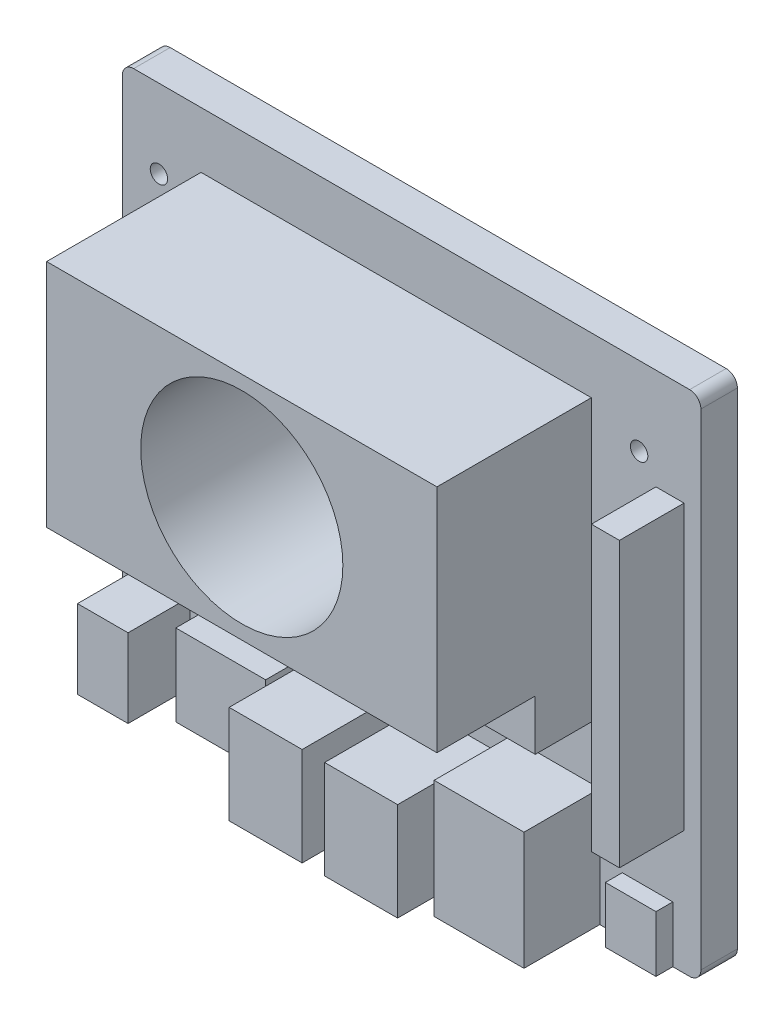
from build123d import *

# Parameters (mm, degrees)
SKETCH_1_W          = 103
SKETCH_1_H          = 90.5
EXTRUDE_1_DEPTH     = 6.5
SKETCH_2_W          = 9
SKETCH_2_H          = 14
SKETCH_2_W_2        = 16
SKETCH_2_H_2        = 14.5
SKETCH_2_W_3        = 13
SKETCH_2_H_3        = 17.5
SKETCH_2_H_4        = 21
SKETCH_2_H_5        = 10
SKETCH_2_W_4        = 69.5
SKETCH_2_H_6        = 50
SKETCH_2_R          = 18
SKETCH_2_W_5        = 2.5
SKETCH_2_H_7        = 19
SKETCH_2_W_6        = 5
SKETCH_2_H_8        = 50.5
EXTRUDE_2_DEPTH     = 27.5
CUT_EXTRUDE_1_REACH = 143.263
SKETCH_3_W          = 9
SKETCH_3_H          = 16.5
SKETCH_3_W_2        = 16
SKETCH_3_H_2        = 21
SKETCH_3_W_3        = 13
SKETCH_3_H_3        = 10.5
SKETCH_3_H_4        = 14
SKETCH_3_H_5        = 24.5
SKETCH_4_W          = 69.5
SKETCH_4_H          = 9
CUT_EXTRUDE_2_DEPTH = 17.5
SKETCH_5_R          = 1.55
CUT_EXTRUDE_3_DEPTH = 140.840981118
CUT_EXTRUDE_4_REACH = 135.8
SKETCH_6_W          = 21
SKETCH_6_H          = 19
CUT_EXTRUDE_5_REACH = 141.091
SKETCH_7_W          = 16
SKETCH_7_H          = 50.5
FILLET_1_R          = 2


with BuildPart() as part:
    # 草图1 → 凸台-拉伸1 (new body)
    with BuildSketch(Plane.XY):
        with Locations((51.5, 45.25)):
            Rectangle(SKETCH_1_W, SKETCH_1_H)
    extrude(amount=EXTRUDE_1_DEPTH)

    # 草图2 → 凸台-拉伸2 (add)
    # profile 1 of 9: a face of its own
    with BuildSketch(Plane.XY.offset(6.5)):
        with Locations((7.5, 7)):
            Rectangle(SKETCH_2_W, SKETCH_2_H)
    # profile 2 of 9: a face of its own
    with BuildSketch(Plane.XY.offset(6.5)):
        with Locations((24, 7.25)):
            Rectangle(SKETCH_2_W_2, SKETCH_2_H_2)
    # profile 3 of 9: a face of its own
    with BuildSketch(Plane.XY.offset(6.5)):
        with Locations((42.5, 8.75)):
            Rectangle(SKETCH_2_W_3, SKETCH_2_H_3)
    # profile 4 of 9: a face of its own
    with BuildSketch(Plane.XY.offset(6.5)):
        with Locations((59.5, 8.75)):
            Rectangle(SKETCH_2_W_3, SKETCH_2_H_3)
    # profile 5 of 9: a face of its own
    with BuildSketch(Plane.XY.offset(6.5)):
        with Locations((77, 10.5)):
            Rectangle(SKETCH_2_W_2, SKETCH_2_H_4)
    # profile 6 of 9: a face of its own
    with BuildSketch(Plane.XY.offset(6.5)):
        with Locations((93.5, 5)):
            Rectangle(SKETCH_2_W, SKETCH_2_H_5)
    # profile 7 of 9: a face of its own
    with BuildSketch(Plane.XY.offset(6.5)):
        with Locations((48.75, 55.5)):
            Rectangle(SKETCH_2_W_4, SKETCH_2_H_6)
        with Locations((48.75, 60)):
            Circle(SKETCH_2_R, mode=Mode.SUBTRACT)
    # profile 8 of 9: a face of its own
    with BuildSketch(Plane.XY.offset(6.5)):
        with Locations((91.25, 58)):
            Rectangle(SKETCH_2_W_5, SKETCH_2_H_7)
    # profile 9 of 9: a face of its own
    with BuildSketch(Plane.XY.offset(6.5)):
        with Locations((97.5, 47.25)):
            Rectangle(SKETCH_2_W_6, SKETCH_2_H_8)
    extrude(amount=EXTRUDE_2_DEPTH)

    # 草图3 → 切除-拉伸1 (cut, up to next)
    with BuildSketch(Plane.XZ, mode=Mode.PRIVATE) as cut_extrude_1_sk1:
        with Locations((7.5, 25.75)):
            Rectangle(SKETCH_3_W, SKETCH_3_H)
    cut_extrude_1_tool1 = extrude(cut_extrude_1_sk1.sketch, amount=-CUT_EXTRUDE_1_REACH, mode=Mode.PRIVATE) & part.part
    # 草图3 → 切除-拉伸1 (cut, up to next)
    with BuildSketch(Plane.XZ, mode=Mode.PRIVATE) as cut_extrude_1_sk2:
        with Locations((24, 23.5)):
            Rectangle(SKETCH_3_W_2, SKETCH_3_H_2)
    cut_extrude_1_tool2 = extrude(cut_extrude_1_sk2.sketch, amount=-CUT_EXTRUDE_1_REACH, mode=Mode.PRIVATE) & part.part
    # 草图3 → 切除-拉伸1 (cut, up to next)
    with BuildSketch(Plane.XZ, mode=Mode.PRIVATE) as cut_extrude_1_sk3:
        with Locations((42.5, 28.75)):
            Rectangle(SKETCH_3_W_3, SKETCH_3_H_3)
    cut_extrude_1_tool3 = extrude(cut_extrude_1_sk3.sketch, amount=-CUT_EXTRUDE_1_REACH, mode=Mode.PRIVATE) & part.part
    # 草图3 → 切除-拉伸1 (cut, up to next)
    with BuildSketch(Plane.XZ, mode=Mode.PRIVATE) as cut_extrude_1_sk4:
        with Locations((59.5, 28.75)):
            Rectangle(SKETCH_3_W_3, SKETCH_3_H_3)
    cut_extrude_1_tool4 = extrude(cut_extrude_1_sk4.sketch, amount=-CUT_EXTRUDE_1_REACH, mode=Mode.PRIVATE) & part.part
    # 草图3 → 切除-拉伸1 (cut, up to next)
    with BuildSketch(Plane.XZ, mode=Mode.PRIVATE) as cut_extrude_1_sk5:
        with Locations((77, 27)):
            Rectangle(SKETCH_3_W_2, SKETCH_3_H_4)
    cut_extrude_1_tool5 = extrude(cut_extrude_1_sk5.sketch, amount=-CUT_EXTRUDE_1_REACH, mode=Mode.PRIVATE) & part.part
    # 草图3 → 切除-拉伸1 (cut, up to next)
    with BuildSketch(Plane.XZ, mode=Mode.PRIVATE) as cut_extrude_1_sk6:
        with Locations((93.5, 21.75)):
            Rectangle(SKETCH_3_W, SKETCH_3_H_5)
    cut_extrude_1_tool6 = extrude(cut_extrude_1_sk6.sketch, amount=-CUT_EXTRUDE_1_REACH, mode=Mode.PRIVATE) & part.part
    add(cut_extrude_1_tool1.solids().sort_by_distance((7.5, 0, 25.75))[0], mode=Mode.SUBTRACT)
    add(cut_extrude_1_tool2.solids().sort_by_distance((24, 0, 23.5))[0], mode=Mode.SUBTRACT)
    add(cut_extrude_1_tool3.solids().sort_by_distance((42.5, 0, 28.75))[0], mode=Mode.SUBTRACT)
    add(cut_extrude_1_tool4.solids().sort_by_distance((59.5, 0, 28.75))[0], mode=Mode.SUBTRACT)
    add(cut_extrude_1_tool5.solids().sort_by_distance((77, 0, 27))[0], mode=Mode.SUBTRACT)
    add(cut_extrude_1_tool6.solids().sort_by_distance((93.5, 0, 21.75))[0], mode=Mode.SUBTRACT)

    # 草图4 → 切除-拉伸2 (cut)
    with BuildSketch(Plane.XY.offset(34)):
        with Locations((48.75, 35)):
            Rectangle(SKETCH_4_W, SKETCH_4_H)
    extrude(amount=-CUT_EXTRUDE_2_DEPTH, mode=Mode.SUBTRACT)

    # 草图5 → 切除-拉伸3 (cut, through all)
    with BuildSketch(Plane.XY.offset(6.5)):
        with Locations((92, 19)):
            Circle(SKETCH_5_R)
        with Locations((92, 76.5)):
            Circle(SKETCH_5_R)
        with Locations((6.5, 76.5)):
            Circle(SKETCH_5_R)
        with Locations((6.5, 19.5)):
            Circle(SKETCH_5_R)
    extrude(amount=-CUT_EXTRUDE_3_DEPTH, mode=Mode.SUBTRACT)

    # 草图6 → 切除-拉伸4 (cut, up to next)
    with BuildSketch(Plane(origin=(92.5, 0, 0), x_dir=(0, 0, -1), z_dir=(1, 0, 0)), mode=Mode.PRIVATE) as cut_extrude_4_sk1:
        with Locations((-23.5, 58)):
            Rectangle(SKETCH_6_W, SKETCH_6_H)
    cut_extrude_4_tool1 = extrude(cut_extrude_4_sk1.sketch, amount=-CUT_EXTRUDE_4_REACH, mode=Mode.PRIVATE) & part.part
    add(cut_extrude_4_tool1.solids().sort_by_distance((92.5, 58, 23.5))[0], mode=Mode.SUBTRACT)

    # 草图7 → 切除-拉伸5 (cut, up to next)
    with BuildSketch(Plane(origin=(100, 0, 0), x_dir=(0, 0, -1), z_dir=(1, 0, 0)), mode=Mode.PRIVATE) as cut_extrude_5_sk1:
        with Locations((-26, 47.25)):
            Rectangle(SKETCH_7_W, SKETCH_7_H)
    cut_extrude_5_tool1 = extrude(cut_extrude_5_sk1.sketch, amount=-CUT_EXTRUDE_5_REACH, mode=Mode.PRIVATE) & part.part
    add(cut_extrude_5_tool1.solids().sort_by_distance((100, 47.25, 26))[0], mode=Mode.SUBTRACT)

    # 圆角1
    fillet_1_edges = [part.edges().sort_by_distance(p)[0] for p in [
        (0, 90.5, 3.25),
        (103, 90.5, 3.25),
        (103, 0, 3.25),
        (0, 0, 3.25),
    ]]
    fillet(fillet_1_edges, radius=FILLET_1_R)


solid = part.part
